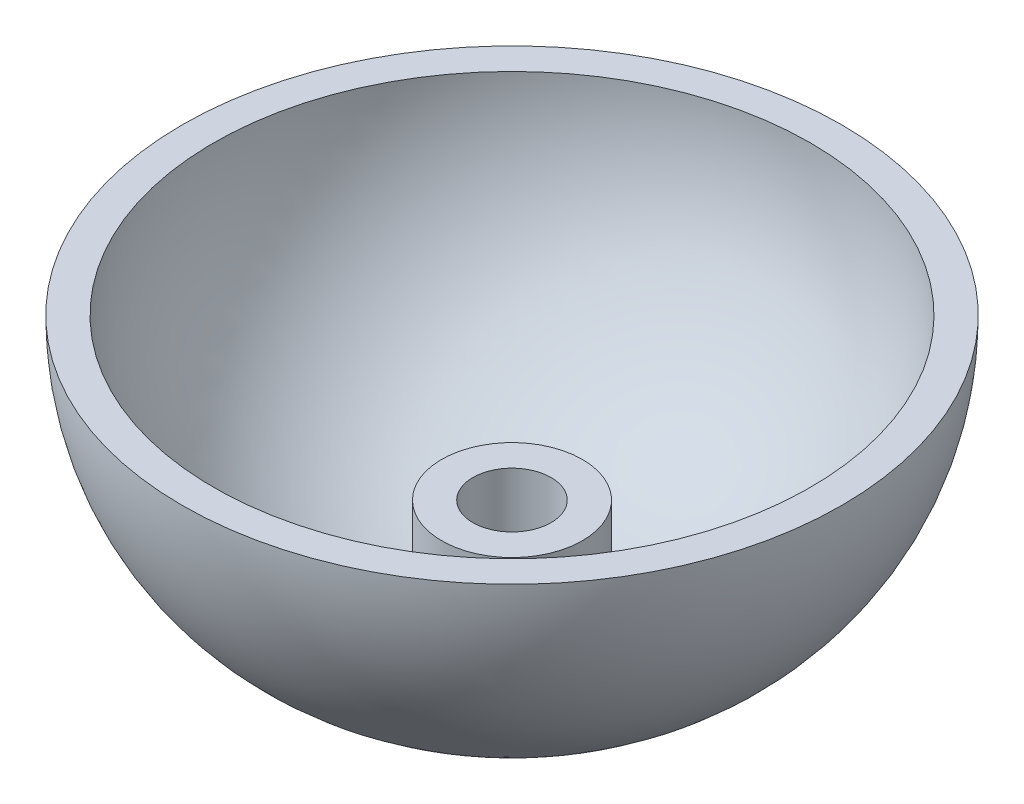
from build123d import *


with BuildPart() as part:
    # Sketch2 → Revolve-Thin1 (revolve)
    with BuildSketch(Plane.XY, mode=Mode.PRIVATE) as revolve_thin1_sk:
        with BuildLine():
            Line((-1.5, 5), (-1.5, 0))
            ThreePointArc((-1.5, 0), (-9.378573435, 3.263411969), (-12.641985405, 11.141985405))
            Line((-12.641985405, 11.141985405), (-11.441985405, 11.141985405))
            ThreePointArc((-11.441985405, 11.141985405), (-8.94222602, 4.549842684), (-2.7, 1.272685846))
            Line((-2.7, 1.272685846), (-2.7, 5))
            Line((-2.7, 5), (-1.5, 5))
        make_face()
    revolve(revolve_thin1_sk.sketch.rotate(Axis((0, 0, 0), (0, 1, 0)), 270), axis=Axis((0, 0, 0), (0, 1, 0)))


solid = part.part
